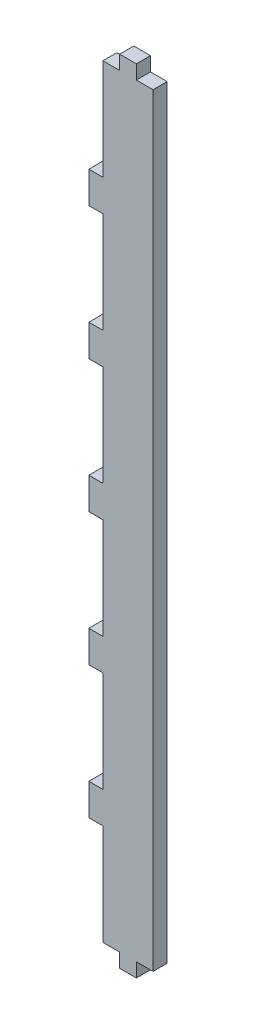
from build123d import *

# Parameters (mm, degrees)
BOSS_EXTRUDE1_DEPTH = 5.35


with BuildPart() as part:
    # Model → Boss-Extrude1 (new body)
    with BuildSketch(Plane.XY):
        Polygon((24.40000046, 295.350003988), (18.050000072, 295.350003988), (18.050000072, 300.700005144), (11.700000148, 300.700005144), (11.700000148, 295.350003988), (5.350000225, 295.350003988), (5.350000225, 257.016671356), (0, 257.016671356), (0, 245.016671717), (5.350000225, 245.016671717), (5.350000225, 206.683337688), (0, 206.683337688), (0, 194.683335722), (5.350000225, 194.683335722), (5.350000225, 156.350001693), (0, 156.350001693), (0, 144.350007176), (5.350000225, 144.350007176), (5.350000225, 106.016665697), (0, 106.016665697), (0, 94.016671181), (5.350000225, 94.016671181), (5.350000225, 55.683344603), (0, 55.683344603), (0, 43.683335185), (5.350000225, 43.683335185), (5.350000225, 5.349993706), (11.700000148, 5.349993706), (11.700000148, 0), (18.050000072, 0), (18.050000072, 5.349993706), (24.40000046, 5.349993706), align=None)
    extrude(amount=BOSS_EXTRUDE1_DEPTH)


solid = part.part
